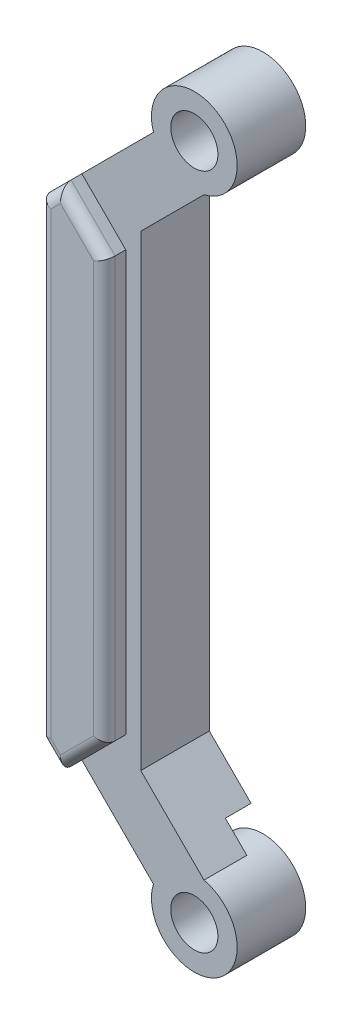
from build123d import *
from build123d.topology import SkipClean

# Parameters (mm, degrees)
EXTRUDE_1_DEPTH      = 3.2
SKETCH_2_R           = 1.1
CUT_EXTRUDE_1_DEPTH  = 3.2
EXTRUDE_2_DEPTH      = 1
FILLET_2_R           = 0.5
CUT_EXTRUDE_10_DEPTH = 3.7
SKETCH_9_W           = 0.5
SKETCH_9_H           = 19.185786438
CUT_EXTRUDE_11_DEPTH = 2
CUT_EXTRUDE_12_DEPTH = 3.2
CUT_EXTRUDE_13_DEPTH = 2.2
CUT_EXTRUDE_14_DEPTH = 1.2
SKETCH_15_W          = 2.5
SKETCH_15_H          = 1
EXTRUDE_3_DEPTH      = 1


with BuildPart() as part:
    # 草图1 → 凸台-拉伸1 (new body)
    with BuildSketch(Plane.XY):
        with BuildLine():
            Line((-6.2, 0), (-6.2, 10.9))
            Line((-6.2, 10.9), (-1.905985669, 15.194014331))
            ThreePointArc((-1.905985669, 15.194014331), (0.989561851, 17.538035484), (0.451668523, 13.851668523))
            Line((0.451668523, 13.851668523), (-2, 11.4))
            Line((-2, 11.4), (-2, 0))
            Line((-2, 0), (-2, -11.4))
            Line((-2, -11.4), (0.451668523, -13.851668523))
            ThreePointArc((0.451668523, -13.851668523), (0.989561851, -17.538035484), (-1.905985669, -15.194014331))
            Line((-1.905985669, -15.194014331), (-6.2, -10.9))
            Line((-6.2, -10.9), (-6.2, 0))
        make_face()
    extrude(amount=EXTRUDE_1_DEPTH)

    # 草图2 → 切除-拉伸1 (cut)
    with BuildSketch(Plane.XY.offset(3.2)):
        with Locations((0, 15.8)):
            Circle(SKETCH_2_R)
        with Locations((0, -15.8)):
            Circle(SKETCH_2_R)
    extrude(amount=-CUT_EXTRUDE_1_DEPTH, mode=Mode.SUBTRACT)

    # 草图3 → 凸台-拉伸2 (add)
    with BuildSketch(Plane.XY.offset(3.2)):
        Polygon((-3.2, 0), (-3.2, 9.8), (-5.25, 11.85), (-6.2, 10.9), (-6.2, -10.9), (-5.25, -11.85), (-3.2, -9.8), align=None)
    extrude(amount=EXTRUDE_2_DEPTH)

    # 圆角2
    fillet_2_edges = [part.edges().sort_by_distance(p)[0] for p in [
        (-4.225, -10.825, 4.2),
        (-5.725, -11.375, 4.2),
        (-3.2, 0, 4.2),
        (-4.225, 10.825, 4.2),
        (-5.725, 11.375, 4.2),
        (-6.2, 0, 4.2),
    ]]
    fillet(fillet_2_edges, radius=FILLET_2_R)

    # 草图7 → 切除-拉伸10 (cut)
    with BuildSketch(Plane.XY):
        Polygon((-5.25, 11.142893219), (-3.7, 9.592893219), (-3.7, -9.592893219), (-5.25, -11.142893219), (-5.7, -10.692893219), (-5.7, 10.692893219), align=None)
    extrude(amount=CUT_EXTRUDE_10_DEPTH, mode=Mode.SUBTRACT)

    # 草图9 → 切除-拉伸11 (cut)
    with BuildSketch(Plane(origin=(0, 0, 0), x_dir=(-1, 0, 0), z_dir=(0, 0, -1))):
        with Locations((3.45, 0)):
            Rectangle(SKETCH_9_W, SKETCH_9_H)
    extrude(amount=-CUT_EXTRUDE_11_DEPTH, mode=Mode.SUBTRACT)

    # 草图10 → 切除-拉伸12 (cut)
    with BuildSketch(Plane.XY.offset(3.2)):
        Polygon((-2.5, 10.9), (-2.5, -10.9), (-2, -11.4), (-2, 11.4), align=None)
    extrude(amount=-CUT_EXTRUDE_12_DEPTH, mode=Mode.SUBTRACT)

    # 草图12 → 切除-拉伸13 (cut)
    with BuildSketch(Plane(origin=(0, 0, 0), x_dir=(-1, 0, 0), z_dir=(0, 0, -1))):
        Polygon((3.63137085, 10.617157288), (4.632842712, 11.61862915), (1.804415588, 14.447056275), (0.802943725, 13.445584413), align=None)
        Polygon((1.804415588, -14.447056275), (0.802943725, -13.445584413), (3.63137085, -10.617157288), (4.632842712, -11.61862915), align=None)
    extrude(amount=-CUT_EXTRUDE_13_DEPTH, mode=Mode.SUBTRACT)

    # 草图14 → 切除-拉伸14 (cut)
    with SkipClean():  # the faces are left unmerged after this step: merging them gives an invalid solid
        with BuildSketch(Plane(origin=(0, 0, 0), x_dir=(-1, 0, 0), z_dir=(0, 0, -1))):
            with BuildLine():
                Line((1.905985669, -15.194014331), (2.669282051, -14.430717949))
                ThreePointArc((2.669282051, -14.430717949), (1.792734548, -13.394568055), (0.549285568, -12.850714432))
                Line((0.549285568, -12.850714432), (-0.451668523, -13.851668523))
                ThreePointArc((-0.451668523, -13.851668523), (0.989561851, -14.061964516), (1.905985669, -15.194014331))
            make_face()
            with BuildLine():
                Line((-0.451668523, 13.851668523), (0.549285568, 12.850714432))
                ThreePointArc((0.549285568, 12.850714432), (1.792734548, 13.394568055), (2.669282051, 14.430717949))
                Line((2.669282051, 14.430717949), (1.905985669, 15.194014331))
                ThreePointArc((1.905985669, 15.194014331), (0.989561851, 14.061964516), (-0.451668523, 13.851668523))
            make_face()
        extrude(amount=-CUT_EXTRUDE_14_DEPTH, mode=Mode.SUBTRACT)

    # 草图15 → 凸台-拉伸3 (add)
    with SkipClean():  # the faces are left unmerged after this step: merging them gives an invalid solid
        with BuildSketch(Plane(origin=(0, 0, 0), x_dir=(-1, 0, 0), z_dir=(0, 0, -1))):
            with Locations((4.45, 2)):
                Rectangle(SKETCH_15_W, SKETCH_15_H)
            with Locations((4.45, -2)):
                Rectangle(SKETCH_15_W, SKETCH_15_H)
        extrude(amount=-EXTRUDE_3_DEPTH)


solid = part.part
